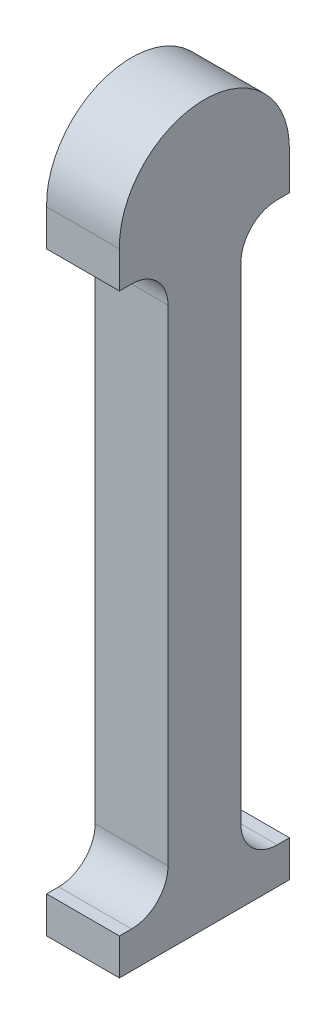
from build123d import *

# Parameters (mm, degrees)
SKETCH1_W           = 3
SKETCH1_H           = 3
BOSS_EXTRUDE1_DEPTH = 23
SKETCH3_W           = 3
SKETCH3_H           = 7
BOSS_EXTRUDE2_DEPTH = 1.5
FILLET1_R           = 1.5
BOSS_EXTRUDE3_DEPTH = 3


with BuildPart() as part:
    # Sketch1 → Boss-Extrude1 (new body)
    with BuildSketch(Plane(origin=(0, 0, 0), x_dir=(1, 0, 0), z_dir=(0, 1, 0))):
        Rectangle(SKETCH1_W, SKETCH1_H)
    extrude(amount=BOSS_EXTRUDE1_DEPTH)

    # Sketch3 → Boss-Extrude2 (add)
    with BuildSketch(Plane(origin=(0, 23, 0), x_dir=(1, 0, 0), z_dir=(0, 1, 0))):
        Rectangle(SKETCH3_W, SKETCH3_H)
    boss_extrude2 = extrude(amount=BOSS_EXTRUDE2_DEPTH)

    # Mirror2: Boss-Extrude2 across plane
    add(boss_extrude2.mirror(Plane(origin=(0, 11.5, 0), x_dir=(0, 0, 1), z_dir=(0, -1, 0))))

    # Fillet1
    fillet1_edges = [part.edges().sort_by_distance(p)[0] for p in [
        (0, 23, 1.5),
        (0, 0, 1.5),
        (0, 0, -1.5),
        (0, 23, -1.5),
    ]]
    fillet(fillet1_edges, radius=FILLET1_R)

    # Sketch4 → Boss-Extrude3 (add)
    with BuildSketch(Plane.ZY.offset(1.5)):
        with BuildLine():
            Line((-3.5, 24.5), (3.5, 24.5))
            ThreePointArc((3.5, 24.5), (0, 28.077563248), (-3.5, 24.5))
        make_face()
    extrude(amount=-BOSS_EXTRUDE3_DEPTH)


solid = part.part
